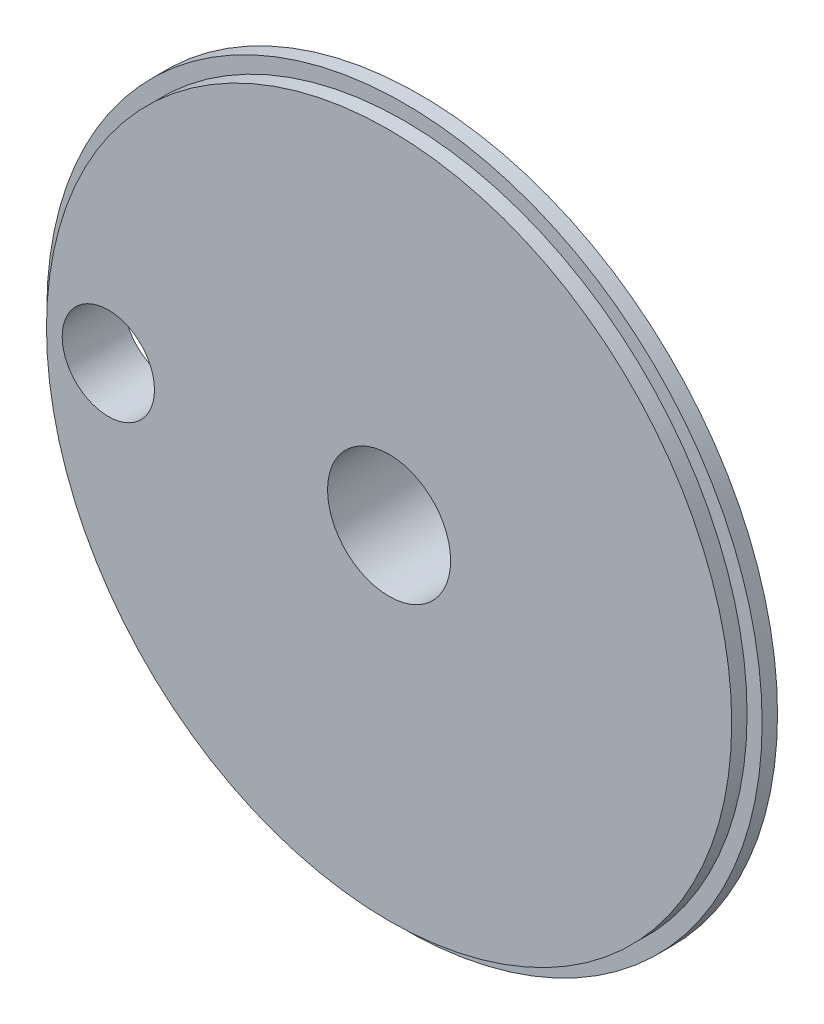
from build123d import *
from build123d.topology import SkipClean

# Parameters (mm, degrees)
SKETCH7_R            = 46.5
SKETCH7_R_2          = 8
SKETCH7_R_3          = 6
BOSS_EXTRUDE9_DEPTH  = 2
SKETCH8_R            = 44.542418889
SKETCH8_R_2          = 8
SKETCH8_R_3          = 6
BOSS_EXTRUDE10_DEPTH = 2
BOSS_EXTRUDE11_START = 8
SKETCH9_R            = 10
SKETCH9_R_2          = 8
BOSS_EXTRUDE11_DEPTH = 8
BOSS_EXTRUDE12_START = 4
SKETCH9_3_R          = 8
SKETCH9_3_R_2        = 6
BOSS_EXTRUDE12_DEPTH = 4


with BuildPart() as part:
    # Sketch7 → Boss-Extrude9 (new body)
    with BuildSketch(Plane.XY):
        Circle(SKETCH7_R)
        Circle(SKETCH7_R_2, mode=Mode.SUBTRACT)
        with Locations((-36.5, 0)):
            Circle(SKETCH7_R_3, mode=Mode.SUBTRACT)
    extrude(amount=BOSS_EXTRUDE9_DEPTH)

    # Sketch8 → Boss-Extrude10 (add)
    with BuildSketch(Plane.XY.offset(2)):
        Circle(SKETCH8_R)
        Circle(SKETCH8_R_2, mode=Mode.SUBTRACT)
        with Locations((-36.5, 0)):
            Circle(SKETCH8_R_3, mode=Mode.SUBTRACT)
    extrude(amount=BOSS_EXTRUDE10_DEPTH)

    # Sketch9 → Boss-Extrude11 (add)
    with SkipClean():  # the faces are left unmerged after this step: merging them gives an invalid solid
        with BuildSketch(Plane(origin=(0, 0, 0), x_dir=(-1, 0, 0), z_dir=(0, 0, -1)).offset(BOSS_EXTRUDE11_START)):
            Circle(SKETCH9_R)
            Circle(SKETCH9_R_2, mode=Mode.SUBTRACT)
        extrude(amount=-BOSS_EXTRUDE11_DEPTH)

    # Sketch9<3> → Boss-Extrude12 (add)
    with BuildSketch(Plane(origin=(0, 0, 0), x_dir=(-1, 0, 0), z_dir=(0, 0, -1)).offset(BOSS_EXTRUDE12_START)):
        with Locations((36.5, 0)):
            Circle(SKETCH9_3_R)
        with Locations((36.5, 0)):
            Circle(SKETCH9_3_R_2, mode=Mode.SUBTRACT)
    extrude(amount=-BOSS_EXTRUDE12_DEPTH)


solid = part.part
